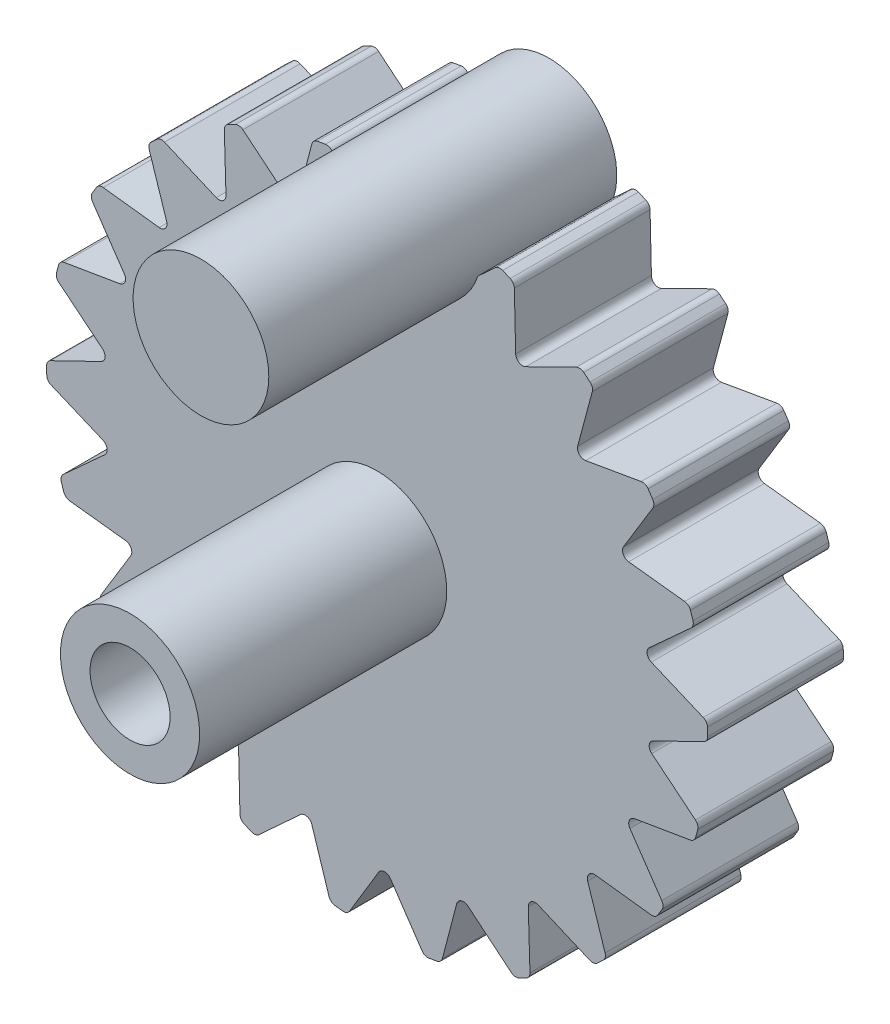
from build123d import *

# Parameters (mm, degrees)
ESQUISSE1_R                        = 4.75
BOSS_EXTRU_1_DEPTH                 = 1.95
ENL_V_MAT_EXTRU_1_DEPTH            = 1.95
CONG_1_R                           = 0.1
R_P_TITION_CIRCULAIRE1_COUNT       = 22
CONG_1_OF_R_P_TITION_CIRCULAIRE1_R = 0.1
BOSS_EXTRU_2_START                 = -1.95
ESQUISSE3_R                        = 1
BOSS_EXTRU_2_DEPTH                 = 6.75
BOSS_EXTRU_3_START                 = -1.95
ESQUISSE4_R                        = 0.975
BOSS_EXTRU_3_DEPTH                 = 5
ENL_V_MAT_EXTRU_2_DEPTH            = 1.25
ESQUISSE6_R                        = 0.575
ENL_V_MAT_EXTRU_3_DEPTH            = 8.25
SCALE1_SCALE                       = 6.5


with BuildPart() as part:
    # Esquisse1 → Boss.-Extru.1 (new body)
    with BuildSketch(Plane.XY):
        Circle(ESQUISSE1_R)
    extrude(amount=BOSS_EXTRU_1_DEPTH)

    # Esquisse2 → Enlèv. mat.-Extru.1 (cut)
    with BuildSketch(Plane.XY.offset(1.95)):
        Polygon((3.117520664, 3.62962669), (3.893534217, 2.780920046), (2.841322241, 2.597958414), align=None)
    enl_v_mat_extru_1 = extrude(amount=-ENL_V_MAT_EXTRU_1_DEPTH, mode=Mode.SUBTRACT)

    # Congé1
    cong_1_edges = [part.edges().sort_by_distance(p)[0] for p in [
        (3.107562447, 3.592430325, 0.975),
        (2.841322241, 2.597958414, 0.975),
        (3.855597157, 2.774323442, 0.975),
    ]]
    fillet(cong_1_edges, radius=CONG_1_R)

    # Répétition circulaire1: Enlèv. mat.-Extru.1 ×22 about axis
    r_p_tition_circulaire1_axis = Axis((0, 0, 0), (0, 0, 1))
    for i in range(1, R_P_TITION_CIRCULAIRE1_COUNT):
        add(enl_v_mat_extru_1.rotate(r_p_tition_circulaire1_axis, i * 360 / R_P_TITION_CIRCULAIRE1_COUNT), mode=Mode.SUBTRACT)

    # Congé1 of Répétition circulaire1
    cong_1_of_r_p_tition_circulaire1_edges = [part.edges().sort_by_distance(p)[0] for p in [
        (1.969579752, 4.322413169, 0.975),
        (1.99429926, 3.293215824, 0.975),
        (2.917801145, 3.748191094, 0.975),
        (0.672033419, 4.702219804, 0.975),
        (0.985710013, 3.721676473, 0.975),
        (1.743622236, 4.418402596, 0.975),
        (-0.679957064, 4.701080556, 0.975),
        (-0.102735597, 3.848629028, 0.975),
        (0.428185424, 4.730661396, 0.975),
        (-1.976861471, 4.319087719, 0.975),
        (-1.18285818, 3.663788548, 0.975),
        (-0.921940425, 4.659670144, 0.975),
        (-3.113612317, 3.587188082, 0.975),
        (-2.167152628, 3.182129709, 0.975),
        (-2.197376144, 4.21118013, 0.975),
        (-3.998116811, 2.564675801, 0.975),
        (-2.975877259, 2.442673646, 0.975),
        (-3.294793515, 3.421525346, 0.975),
        (-4.558717659, 1.334388739, 0.975),
        (-3.543514012, 1.505326691, 0.975),
        (-4.125286311, 2.354678927, 0.975),
        (-4.749998314, -0.004002563, 0.975),
        (-3.824076334, 0.446027121, 0.975),
        (-4.621572945, 1.097070425, 0.975),
        (-4.556462354, -1.342069601, 0.975),
        (-3.794834734, -0.649406915, 0.975),
        (-4.743447223, -0.249416198, 0.975),
        (-3.993788913, -2.571410141, 0.975),
        (-3.458158193, -1.692229864, 0.975),
        (-4.481035618, -1.575696604, 0.975),
        (-3.107562447, -3.592430325, 0.975),
        (-2.841322241, -2.597958414, 0.975),
        (-3.855597157, -2.774323442, 0.975),
        (-1.969579752, -4.322413169, 0.975),
        (-1.99429926, -3.293215824, 0.975),
        (-2.917801145, -3.748191094, 0.975),
        (-0.672033419, -4.702219804, 0.975),
        (-0.985710013, -3.721676473, 0.975),
        (-1.743622236, -4.418402596, 0.975),
        (0.679957064, -4.701080556, 0.975),
        (0.102735597, -3.848629028, 0.975),
        (-0.428185424, -4.730661396, 0.975),
        (1.976861471, -4.319087719, 0.975),
        (1.18285818, -3.663788548, 0.975),
        (0.921940425, -4.659670144, 0.975),
        (3.113612317, -3.587188082, 0.975),
        (2.167152628, -3.182129709, 0.975),
        (2.197376144, -4.21118013, 0.975),
        (3.998116811, -2.564675801, 0.975),
        (2.975877259, -2.442673646, 0.975),
        (3.294793515, -3.421525346, 0.975),
        (4.558717659, -1.334388739, 0.975),
        (3.543514012, -1.505326691, 0.975),
        (4.125286311, -2.354678927, 0.975),
        (4.749998314, 0.004002563, 0.975),
        (3.824076334, -0.446027121, 0.975),
        (4.621572945, -1.097070425, 0.975),
        (4.556462354, 1.342069601, 0.975),
        (3.794834734, 0.649406915, 0.975),
        (4.743447223, 0.249416198, 0.975),
        (3.993788913, 2.571410141, 0.975),
        (3.458158193, 1.692229864, 0.975),
        (4.481035618, 1.575696604, 0.975),
    ]]
    fillet(cong_1_of_r_p_tition_circulaire1_edges, radius=CONG_1_OF_R_P_TITION_CIRCULAIRE1_R)

    # Esquisse3 → Boss.-Extru.2 (add)
    with BuildSketch(Plane.XY.offset(1.95).offset(BOSS_EXTRU_2_START)):
        Circle(ESQUISSE3_R)
    extrude(amount=BOSS_EXTRU_2_DEPTH)

    # Esquisse4 → Boss.-Extru.3 (add)
    with BuildSketch(Plane.XY.offset(1.95).offset(BOSS_EXTRU_3_START)):
        with Locations(Location((0.518434121, 4.444867947, 0), (0, 0, 184.609356903))):
            Circle(ESQUISSE4_R)
    extrude(amount=BOSS_EXTRU_3_DEPTH)

    # Esquisse5 → Enlèv. mat.-Extru.2 (cut)
    with BuildSketch(Plane.XY.offset(6.75)):
        with BuildLine():
            Line((-1.280253792, 1.156103468), (1.511956192, 0.830429692))
            ThreePointArc((1.511956192, 0.830429692), (1.713384851, -0.19984332), (1.280253792, -1.156103468))
            Line((1.280253792, -1.156103468), (-1.511956192, -0.830429692))
            ThreePointArc((-1.511956192, -0.830429692), (-1.713384851, 0.19984332), (-1.280253792, 1.156103468))
        make_face()
    extrude(amount=-ENL_V_MAT_EXTRU_2_DEPTH, mode=Mode.SUBTRACT)

    # Esquisse6 → Enlèv. mat.-Extru.3 (cut)
    with BuildSketch(Plane(origin=(0, 0, 0), x_dir=(-1, 0, 0), z_dir=(0, 0, -1))):
        Circle(ESQUISSE6_R)
    extrude(amount=-ENL_V_MAT_EXTRU_3_DEPTH, mode=Mode.SUBTRACT)


with BuildPart() as part_1:
    # Scale1: scaled about (0.050264048, 0.430945894, 1.295589715)
    add(part.part.scale(SCALE1_SCALE).moved(Location((-0.276452264, -2.370202417, -7.125743433))))


solid = part_1.part
